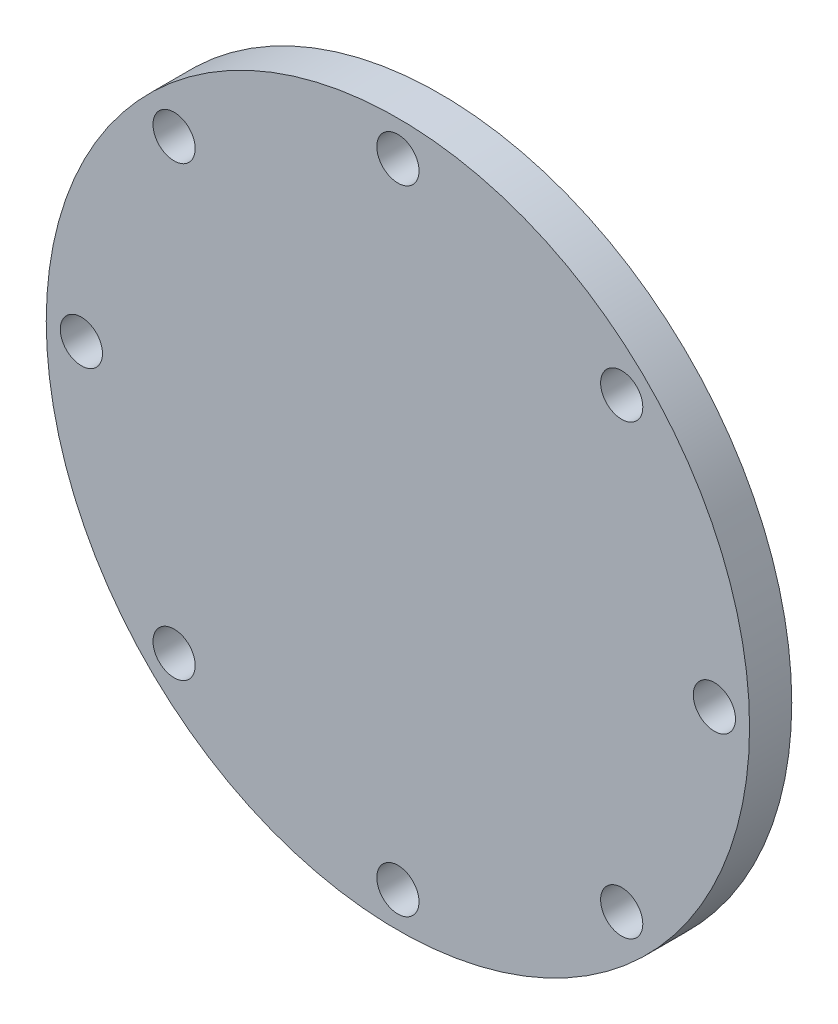
from build123d import *

# Parameters (mm, degrees)
SKETCH1_R           = 25
SKETCH1_R_2         = 1.5
BOSS_EXTRUDE1_DEPTH = 3


with BuildPart() as part:
    # Sketch1 → Boss-Extrude1 (new body)
    with BuildSketch(Plane.XY):
        Circle(SKETCH1_R)
        with Locations((0, 22.5)):
            Circle(SKETCH1_R_2, mode=Mode.SUBTRACT)
        with Locations((15.909902577, 15.909902577)):
            Circle(SKETCH1_R_2, mode=Mode.SUBTRACT)
        with Locations((22.5, 0)):
            Circle(SKETCH1_R_2, mode=Mode.SUBTRACT)
        with Locations((15.909902577, -15.909902577)):
            Circle(SKETCH1_R_2, mode=Mode.SUBTRACT)
        with Locations((0, -22.5)):
            Circle(SKETCH1_R_2, mode=Mode.SUBTRACT)
        with Locations((-15.909902577, -15.909902577)):
            Circle(SKETCH1_R_2, mode=Mode.SUBTRACT)
        with Locations((-22.5, 0)):
            Circle(SKETCH1_R_2, mode=Mode.SUBTRACT)
        with Locations((-15.909902577, 15.909902577)):
            Circle(SKETCH1_R_2, mode=Mode.SUBTRACT)
    extrude(amount=BOSS_EXTRUDE1_DEPTH)


solid = part.part
